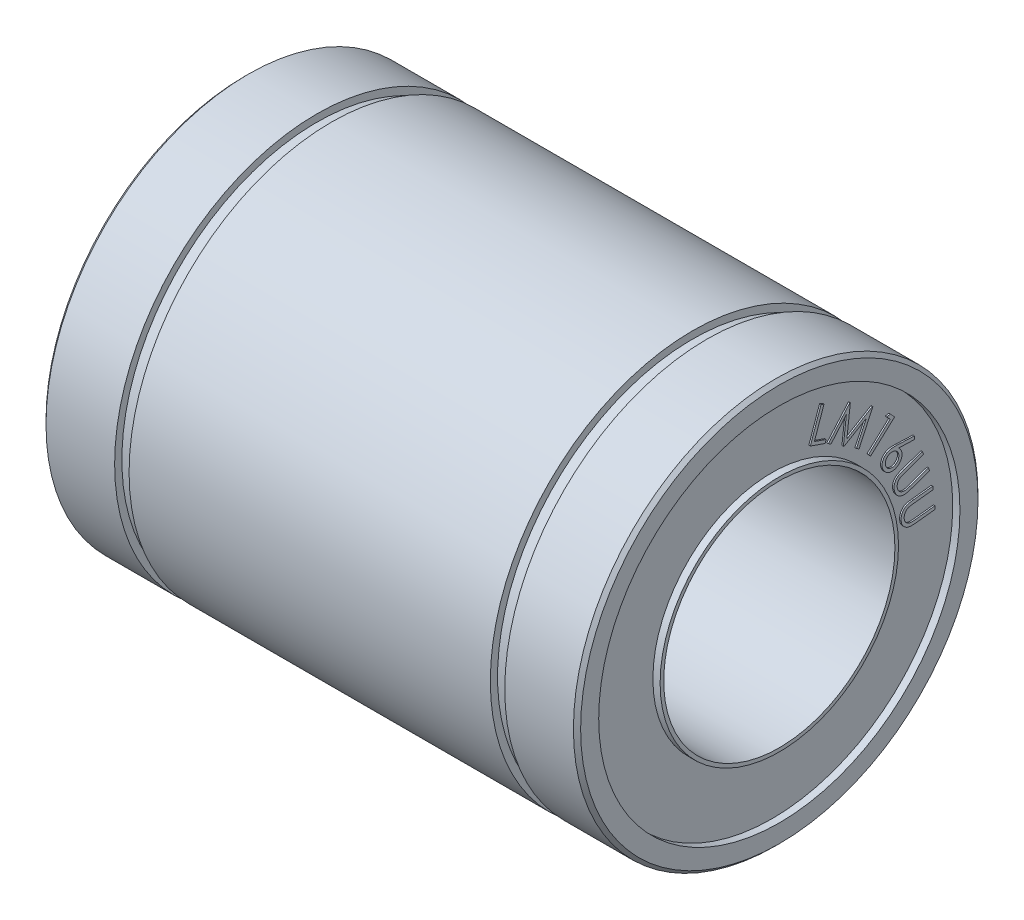
from build123d import *

# Parameters (mm, degrees)
SKETCH1_R           = 14
BOSS_EXTRUDE1_DEPTH = 37
SKETCH2_R           = 8
CUT_EXTRUDE1_DEPTH  = 37
SKETCH3_R           = 12.5
SKETCH3_R_2         = 8.25
CUT_EXTRUDE2_DEPTH  = 0.5
CUT_EXTRUDE3_START  = -36.5
SKETCH3_2_R         = 12.5
SKETCH3_2_R_2       = 8.25
CUT_EXTRUDE3_DEPTH  = 0.5
SKETCH4_W           = 1
SKETCH4_H           = 0.5
CHAMFER1_SIZE       = 0.25
BOSS_EXTRUDE2_DEPTH = 0.1
BOSS_EXTRUDE3_DEPTH = 0.1


with BuildPart() as part:
    # Sketch1 → Boss-Extrude1 (new body)
    with BuildSketch(Plane(origin=(0, 0, 0), x_dir=(0, 0, -1), z_dir=(1, 0, 0))):
        Circle(SKETCH1_R)
    extrude(amount=BOSS_EXTRUDE1_DEPTH)

    # Sketch2 → Cut-Extrude1 (cut)
    with BuildSketch(Plane(origin=(37, 0, 0), x_dir=(0, 0, -1), z_dir=(1, 0, 0))):
        Circle(SKETCH2_R)
    extrude(amount=-CUT_EXTRUDE1_DEPTH, mode=Mode.SUBTRACT)

    # Sketch3 → Cut-Extrude2 (cut)
    with BuildSketch(Plane(origin=(37, 0, 0), x_dir=(0, 0, -1), z_dir=(1, 0, 0))):
        Circle(SKETCH3_R)
        Circle(SKETCH3_R_2, mode=Mode.SUBTRACT)
    extrude(amount=-CUT_EXTRUDE2_DEPTH, mode=Mode.SUBTRACT)

    # Sketch3<2> → Cut-Extrude3 (cut)
    with BuildSketch(Plane(origin=(37, 0, 0), x_dir=(0, 0, -1), z_dir=(1, 0, 0)).offset(CUT_EXTRUDE3_START)):
        Circle(SKETCH3_2_R)
        Circle(SKETCH3_2_R_2, mode=Mode.SUBTRACT)
    extrude(amount=-CUT_EXTRUDE3_DEPTH, mode=Mode.SUBTRACT)

    # Sketch4 → Cut-Revolve1 (revolve, cut)
    with BuildSketch(Plane(origin=(0, 0, 0), x_dir=(1, 0, 0), z_dir=(0, 1, 0))):
        with Locations((31.5, 13.75)):
            Rectangle(SKETCH4_W, SKETCH4_H)
        with Locations((5.5, 13.75)):
            Rectangle(SKETCH4_W, SKETCH4_H)
    revolve(axis=Axis((37, 0, 0), (-1, 0, 0)), mode=Mode.SUBTRACT)

    # Chamfer1
    chamfer1_edges = [part.edges().sort_by_distance(p)[0] for p in [
        (0, 0, 14),
        (37, 0, 14),
    ]]
    chamfer(chamfer1_edges, length=CHAMFER1_SIZE)

    # Sketch5 → Boss-Extrude2 (add)
    # profile 1 of 6: a face of its own
    with BuildSketch(Plane(origin=(36.5, 0, 0), x_dir=(0, 0, -1), z_dir=(1, 0, 0))):
        with BuildLine():
            Line((11.023012647, 1.971806837), (11.04780231, 1.750052029))
            Line((11.04780231, 1.750052029), (9.709160483, 1.599961885))
            add(Edge.make_bspline(
                [(9.709160483, 1.599961885), (9.690222868, 1.597921149), (9.654276339, 1.594047516), (9.603230748, 1.587571213), (9.557846114, 1.581802568), (9.518033464, 1.576374225), (9.483923376, 1.571445809), (9.455324636, 1.567076165), (9.432472951, 1.562684486), (9.419187325, 1.559437758), (9.413487406, 1.558044818)],
                knots=[0, 0, 0, 0, 1.529972016, 2.904124054, 4.133084495, 5.204929471, 6.131682661, 6.901508298, 7.528715184, 8, 8, 8, 8], degree=3))
            add(Edge.make_bspline(
                [(9.413487406, 1.558044818), (9.392747753, 1.552515194), (9.352658543, 1.541826575), (9.296659801, 1.518351992), (9.24628813, 1.490669098), (9.201731633, 1.457237616), (9.162470696, 1.417629135), (9.128536627, 1.370323938), (9.098883075, 1.315668937), (9.074752567, 1.254567096), (9.056006582, 1.190299364), (9.044085043, 1.125076532), (9.039685932, 1.060285132), (9.042800864, 1.017620429), (9.044346781, 0.99644626)],
                knots=[0, 0, 0, 0, 1.044325408, 2.018653799, 2.948987695, 3.837309385, 4.722098006, 5.654415344, 6.662956212, 7.743194244, 8.84781608, 9.918545184, 10.96698973, 12, 12, 12, 12], degree=3))
            add(Edge.make_bspline(
                [(9.044346781, 0.99644626), (9.046911374, 0.978326506), (9.052018369, 0.942243775), (9.067555744, 0.889669421), (9.087526664, 0.838528544), (9.113904018, 0.790061827), (9.14451946, 0.744461067), (9.180730412, 0.704099901), (9.219389449, 0.666853239), (9.26304554, 0.635282177), (9.310699265, 0.60875784), (9.361743264, 0.586455923), (9.41682096, 0.56961161), (9.455165832, 0.56275501), (9.474785483, 0.559246741)],
                knots=[0, 0, 0, 0, 0.994312499, 1.980021912, 2.974132841, 3.976074961, 4.975814495, 5.954586996, 6.920166592, 7.891230619, 8.875617637, 9.882282318, 10.916442249, 12, 12, 12, 12], degree=3))
            add(Edge.make_bspline(
                [(9.474785483, 0.559246741), (9.483039375, 0.558236563), (9.501149688, 0.556020076), (9.531268097, 0.554953642), (9.566741781, 0.555013782), (9.607776907, 0.556419952), (9.654184382, 0.559353328), (9.706067448, 0.562690487), (9.763286423, 0.568342581), (9.803215688, 0.572728579), (9.824094378, 0.575021981)],
                knots=[0, 0, 0, 0, 0.569442986, 1.249445795, 2.062549003, 2.999670387, 4.061589447, 5.248081227, 6.561043948, 8, 8, 8, 8], degree=3))
            Line((9.824094378, 0.575021981), (11.162736205, 0.725112125))
            Line((11.162736205, 0.725112125), (11.187525868, 0.503808039))
            Line((11.187525868, 0.503808039), (9.848884041, 0.353717895))
            add(Edge.make_bspline(
                [(9.848884041, 0.353717895), (9.824708178, 0.351175948), (9.777611344, 0.346224), (9.708466167, 0.341277522), (9.642632883, 0.338522827), (9.580087268, 0.33794248), (9.520874068, 0.339938758), (9.465017207, 0.343056762), (9.412601375, 0.349752679), (9.362943131, 0.357445107), (9.315495715, 0.368959434), (9.269378949, 0.383635546), (9.224648268, 0.402929064), (9.180736778, 0.425288068), (9.138335211, 0.452220569), (9.09681021, 0.482505434), (9.056058017, 0.516274083), (9.017247532, 0.554109207), (8.980015649, 0.594497931), (8.947921856, 0.639132222), (8.91849703, 0.685635629), (8.894134776, 0.735425099), (8.872361759, 0.787418155), (8.856183884, 0.842711947), (8.84269483, 0.900446575), (8.837433785, 0.94019726), (8.834761445, 0.960388568)],
                knots=[0, 0, 0, 0, 1.301517019, 2.535476441, 3.710940068, 4.829130968, 5.88342943, 6.883000234, 7.822914096, 8.711621517, 9.572064124, 10.434459895, 11.299552767, 12.17741742, 13.07019317, 13.985728478, 14.928151944, 15.900983954, 16.886373419, 17.864611659, 18.840100778, 19.82942264, 20.828799209, 21.854348839, 22.910119357, 24, 24, 24, 24], degree=3))
            add(Edge.make_bspline(
                [(8.834761445, 0.960388568), (8.83263526, 0.982454024), (8.828461815, 1.025765851), (8.827816952, 1.090089518), (8.830883261, 1.152414682), (8.837921374, 1.212871914), (8.849684195, 1.271362941), (8.866042223, 1.327809844), (8.886275479, 1.382392741), (8.910537482, 1.434788627), (8.938958035, 1.483998328), (8.970014599, 1.530309711), (9.004412166, 1.572834402), (9.041787677, 1.61162383), (9.082219507, 1.646628244), (9.125700256, 1.677775803), (9.172224362, 1.705567523), (9.205253046, 1.720750668), (9.221930916, 1.728417414)],
                knots=[0, 0, 0, 0, 1.151477449, 2.260211214, 3.338991356, 4.392588726, 5.419971278, 6.435538955, 7.443425264, 8.442382105, 9.432051824, 10.393480485, 11.337216847, 12.270333585, 13.189133071, 14.112135491, 15.046720806, 16, 16, 16, 16], degree=3))
            add(Edge.make_bspline(
                [(9.221930916, 1.728417414), (9.233443958, 1.733076474), (9.258263278, 1.743120274), (9.299606219, 1.755925332), (9.347445003, 1.768446979), (9.401991117, 1.780635315), (9.46324972, 1.7916161), (9.53102022, 1.802429888), (9.605375019, 1.8129), (9.657310924, 1.818696548), (9.68437082, 1.821716693)],
                knots=[0, 0, 0, 0, 0.62976426, 1.35761862, 2.193128689, 3.137921082, 4.191712736, 5.349369248, 6.618955602, 8, 8, 8, 8], degree=3))
            Line((9.68437082, 1.821716693), (11.023012647, 1.971806837))
        make_face()
    # profile 2 of 6: a face of its own
    with BuildSketch(Plane(origin=(36.5, 0, 0), x_dir=(0, 0, -1), z_dir=(1, 0, 0))):
        with BuildLine():
            Line((10.304635883, 4.407349536), (10.379004873, 4.196412036))
            Line((10.379004873, 4.196412036), (9.103013287, 3.747043046))
            add(Edge.make_bspline(
                [(9.103013287, 3.747043046), (9.084973134, 3.740613984), (9.050815512, 3.728441055), (9.002369983, 3.71063583), (8.95912336, 3.695057391), (8.92122361, 3.68071611), (8.889068813, 3.667567531), (8.862064476, 3.656729168), (8.840432802, 3.64753701), (8.828046208, 3.641180776), (8.822664729, 3.638419248)],
                knots=[0, 0, 0, 0, 1.528012504, 2.893172574, 4.118027454, 5.195532393, 6.12598041, 6.889492807, 7.517529131, 8, 8, 8, 8], degree=3))
            add(Edge.make_bspline(
                [(8.822664729, 3.638419248), (8.803814642, 3.628278169), (8.767297907, 3.608632685), (8.717540751, 3.573729419), (8.675077, 3.534742331), (8.638430401, 3.492380851), (8.609203232, 3.44434663), (8.586023855, 3.390543036), (8.569621391, 3.330138506), (8.559688051, 3.264976108), (8.555926855, 3.197756427), (8.559684086, 3.131468599), (8.569587521, 3.067034312), (8.582362418, 3.026062469), (8.58874045, 3.005606748)],
                knots=[0, 0, 0, 0, 1.037782282, 2.010410958, 2.938952049, 3.828281059, 4.718266819, 5.655150867, 6.661280109, 7.745667108, 8.847715622, 9.920653619, 10.961859501, 12, 12, 12, 12], degree=3))
            add(Edge.make_bspline(
                [(8.58874045, 3.005606748), (8.595426822, 2.988461231), (8.608714654, 2.954387931), (8.635343037, 2.906209569), (8.666994722, 2.86111357), (8.703286141, 2.819114373), (8.744351645, 2.782103047), (8.787959644, 2.749261978), (8.834963294, 2.722494899), (8.884662055, 2.701140895), (8.937253531, 2.685981404), (8.992189993, 2.675938332), (9.049796596, 2.671753926), (9.088893265, 2.673754882), (9.108872662, 2.674777421)],
                knots=[0, 0, 0, 0, 0.995576105, 1.978509248, 2.97148967, 3.974746577, 4.976683408, 5.959380889, 6.924993764, 7.898081935, 8.88141894, 9.881868605, 10.917580726, 12, 12, 12, 12], degree=3))
            add(Edge.make_bspline(
                [(9.108872662, 2.674777421), (9.117149093, 2.675737509), (9.135292459, 2.677842186), (9.16492563, 2.683495823), (9.199557055, 2.691840005), (9.239484092, 2.701985245), (9.284212829, 2.715277005), (9.333922122, 2.731141801), (9.388705807, 2.749648506), (9.426942113, 2.762938181), (9.446913527, 2.769879584)],
                knots=[0, 0, 0, 0, 0.568236828, 1.245673133, 2.056114611, 2.998233693, 4.055511394, 5.238583063, 6.557669229, 8, 8, 8, 8], degree=3))
            Line((9.446913527, 2.769879584), (10.722905114, 3.219248575))
            Line((10.722905114, 3.219248575), (10.797274104, 3.008311075))
            Line((10.797274104, 3.008311075), (9.521282518, 2.558942084))
            add(Edge.make_bspline(
                [(9.521282518, 2.558942084), (9.498182078, 2.551020545), (9.453055401, 2.535545829), (9.386525721, 2.514764904), (9.322743909, 2.497225705), (9.261816231, 2.482022759), (9.203396384, 2.470558433), (9.14797963, 2.461229634), (9.095304912, 2.455466429), (9.045077818, 2.451955273), (8.996089296, 2.452338), (8.947687483, 2.45686488), (8.899519254, 2.465579142), (8.851518408, 2.477628858), (8.803854715, 2.494200757), (8.756162208, 2.514319746), (8.708900876, 2.538904162), (8.661974048, 2.566644862), (8.616918217, 2.5982537), (8.574501661, 2.633645126), (8.535762681, 2.673050425), (8.500154347, 2.715845307), (8.467809129, 2.762252066), (8.43925736, 2.812344359), (8.41309394, 2.865806116), (8.39897724, 2.903462733), (8.391775306, 2.922674055)],
                knots=[0, 0, 0, 0, 1.301885919, 2.543232421, 3.714979024, 4.828100692, 5.889958941, 6.888068622, 7.822989329, 8.713812229, 9.570868361, 10.431621696, 11.302046928, 12.178165476, 13.067222264, 13.989569946, 14.935270159, 15.905050795, 16.893894155, 17.866086322, 18.845903127, 19.835524696, 20.830931213, 21.857181809, 22.906795792, 24, 24, 24, 24], degree=3))
            add(Edge.make_bspline(
                [(8.391775306, 2.922674055), (8.384677599, 2.943760312), (8.370717593, 2.985233466), (8.355893259, 3.04807829), (8.344023156, 3.109654709), (8.337994225, 3.170429104), (8.33584265, 3.230397377), (8.339348401, 3.289282778), (8.3462039, 3.347390192), (8.358643525, 3.40396492), (8.374570644, 3.45876778), (8.394942882, 3.510964023), (8.419525303, 3.56001083), (8.446818132, 3.606800153), (8.478544391, 3.650279186), (8.514468074, 3.690394446), (8.553661334, 3.728124016), (8.582375355, 3.750589421), (8.596853431, 3.761916844)],
                knots=[0, 0, 0, 0, 1.15035069, 2.262548104, 3.337289598, 4.392175084, 5.41858764, 6.438209531, 7.440804167, 8.442343836, 9.430983373, 10.390789764, 11.336233204, 12.266637723, 13.190068916, 14.115003483, 15.049554095, 16, 16, 16, 16], degree=3))
            add(Edge.make_bspline(
                [(8.596853431, 3.761916844), (8.606968145, 3.769133712), (8.628876712, 3.784765517), (8.666616499, 3.806501879), (8.710830555, 3.829498342), (8.761877527, 3.853044672), (8.81892271, 3.87848385), (8.882990835, 3.904011593), (8.953414431, 3.931034903), (9.00291615, 3.948765304), (9.028644296, 3.957980546)],
                knots=[0, 0, 0, 0, 0.626710171, 1.357460281, 2.195047274, 3.141321219, 4.193635682, 5.346687564, 6.62096083, 8, 8, 8, 8], degree=3))
            Line((9.028644296, 3.957980546), (10.304635883, 4.407349536))
        make_face()
    # profile 3 of 6: a face of its own
    with BuildSketch(Plane(origin=(36.5, 0, 0), x_dir=(0, 0, -1), z_dir=(1, 0, 0))):
        with BuildLine():
            Line((9.746772234, 5.622091487), (9.739560696, 5.402139564))
            Line((9.739560696, 5.402139564), (8.646111177, 5.440450862))
            add(Edge.make_bspline(
                [(8.646111177, 5.440450862), (8.661774786, 5.426682164), (8.69220566, 5.399932677), (8.733707758, 5.3573113), (8.769373381, 5.313313285), (8.789535554, 5.282421199), (8.799356369, 5.267373939)],
                knots=[0, 0, 0, 0, 1.077802223, 2.093927627, 3.071569074, 4, 4, 4, 4], degree=3))
            add(Edge.make_bspline(
                [(8.799356369, 5.267373939), (8.810292837, 5.24850908), (8.831805412, 5.21140097), (8.856454958, 5.152727712), (8.875129508, 5.093444939), (8.887563505, 5.033049139), (8.892784579, 4.971509245), (8.891882583, 4.908998016), (8.884528031, 4.845610759), (8.871075206, 4.782089251), (8.851771677, 4.719786239), (8.82728249, 4.660016884), (8.796072637, 4.604360405), (8.760378221, 4.551720306), (8.71939708, 4.50239781), (8.672345767, 4.457249809), (8.620576118, 4.41491716), (8.582518644, 4.39050629), (8.563178484, 4.378101102)],
                knots=[0, 0, 0, 0, 1.020111462, 2.006609746, 2.972219884, 3.926903679, 4.887323846, 5.858198153, 6.849450432, 7.870410462, 8.893936148, 9.899881421, 10.888559372, 11.87583487, 12.874696021, 13.884569057, 14.924974033, 16, 16, 16, 16], degree=3))
            add(Edge.make_bspline(
                [(8.563178484, 4.378101102), (8.535734834, 4.362665106), (8.481901226, 4.332385777), (8.396085086, 4.299687447), (8.308461006, 4.279146532), (8.219415464, 4.271078856), (8.130379398, 4.275050231), (8.042751565, 4.291492839), (7.957015482, 4.319924142), (7.874180245, 4.359726111), (7.796772491, 4.4105852), (7.726065928, 4.469886065), (7.66399703, 4.538596111), (7.629856389, 4.590073858), (7.612607571, 4.616081871)],
                knots=[0, 0, 0, 0, 1.036506601, 2.033216742, 3.014385835, 3.993792065, 4.970152704, 5.942172962, 6.922267211, 7.938678482, 8.961724237, 9.966492939, 10.972614702, 12, 12, 12, 12], degree=3))
            add(Edge.make_bspline(
                [(7.612607571, 4.616081871), (7.597726351, 4.642310014), (7.568253498, 4.694255904), (7.537600949, 4.778152827), (7.516673798, 4.86445645), (7.508444456, 4.953051981), (7.511289398, 5.041909268), (7.526864862, 5.129102581), (7.554198838, 5.213907078), (7.593420516, 5.295022581), (7.642770817, 5.370819745), (7.700923303, 5.439547548), (7.767421765, 5.500175084), (7.817371223, 5.533318518), (7.842475359, 5.549976102)],
                knots=[0, 0, 0, 0, 1.011924724, 2.004157542, 2.990049326, 3.989361336, 4.984685489, 5.969218716, 6.956028083, 7.970029198, 8.988182909, 9.987686243, 10.9886297, 12, 12, 12, 12], degree=3))
            add(Edge.make_bspline(
                [(7.842475359, 5.549976102), (7.862562825, 5.561325831), (7.903583031, 5.584502883), (7.970065423, 5.612644026), (8.04163171, 5.635526866), (8.104885366, 5.650439544), (8.158890965, 5.659960693), (8.202959289, 5.665750406), (8.250183045, 5.670093131), (8.300351958, 5.673916896), (8.353732745, 5.675526309), (8.409931246, 5.675796502), (8.469300743, 5.675662008), (8.509846666, 5.673920038), (8.530726561, 5.673022977)],
                knots=[0, 0, 0, 0, 1.169849696, 2.388926373, 3.654468859, 4.978263442, 5.682551577, 6.436100894, 7.232497672, 8.088393346, 8.988365595, 9.941209239, 10.939786517, 12, 12, 12, 12], degree=3))
            Line((8.530726561, 5.673022977), (9.746772234, 5.622091487))
        make_face()
        with BuildLine():
            add(Edge.make_bspline(
                [(8.604194109, 5.211033794), (8.595604893, 5.224451994), (8.578721931, 5.250826806), (8.548975073, 5.28653321), (8.516913265, 5.318952455), (8.481588109, 5.347120021), (8.444037145, 5.372452472), (8.403240238, 5.392836612), (8.360122238, 5.410395984), (8.314534439, 5.423015962), (8.268126604, 5.432090173), (8.22179074, 5.436694017), (8.176053268, 5.436668005), (8.130842195, 5.43232536), (8.086462685, 5.422679892), (8.042907984, 5.408490555), (7.999693645, 5.390133119), (7.972276384, 5.374198553), (7.958310696, 5.366081871)],
                knots=[0, 0, 0, 0, 1.033751752, 2.031942289, 3.011649784, 3.989947241, 4.961457835, 5.947654492, 6.945988081, 7.98066036, 9.013997607, 10.01399862, 10.999471001, 11.980052671, 12.957960795, 13.942273228, 14.951843847, 16, 16, 16, 16], degree=3))
            add(Edge.make_bspline(
                [(7.958310696, 5.366081871), (7.944892496, 5.357492655), (7.918517684, 5.340609693), (7.88281128, 5.310862835), (7.850392035, 5.278801027), (7.822224471, 5.243475871), (7.796892014, 5.205924908), (7.776507891, 5.165127997), (7.758948456, 5.12201001), (7.746328725, 5.076422159), (7.737253598, 5.030014516), (7.732653047, 4.983677965), (7.732666999, 4.938092697), (7.737018109, 4.893020606), (7.746817548, 4.84890052), (7.760155986, 4.805255753), (7.778877457, 4.762606524), (7.794445868, 4.735388725), (7.802361177, 4.721550621)],
                knots=[0, 0, 0, 0, 1.036009441, 2.036380003, 3.018227155, 3.998661191, 4.972293542, 5.960644028, 6.961157955, 7.998089933, 9.033683964, 10.035868956, 11.023493586, 11.996487376, 12.976531228, 13.960032551, 14.962837515, 16, 16, 16, 16], degree=3))
            add(Edge.make_bspline(
                [(7.802361177, 4.721550621), (7.810910015, 4.708096812), (7.82776511, 4.681570957), (7.858237091, 4.646231154), (7.889755932, 4.61311262), (7.925601107, 4.585533068), (7.962942934, 4.56010826), (8.003762515, 4.539718584), (8.046963051, 4.522317819), (8.0923873, 4.508974955), (8.138890428, 4.500081766), (8.185212898, 4.495432118), (8.230801833, 4.495458857), (8.275872959, 4.499806601), (8.319993304, 4.509606944), (8.363638001, 4.522945138), (8.406287249, 4.541666675), (8.433505046, 4.557235077), (8.447343148, 4.565150381)],
                knots=[0, 0, 0, 0, 1.035376435, 2.041373163, 3.029554756, 4.003279005, 4.976316461, 5.964063061, 6.96396567, 8.002979135, 9.037940413, 10.039513066, 11.026534253, 11.998933539, 12.97837858, 13.96127898, 14.963471226, 16, 16, 16, 16], degree=3))
            add(Edge.make_bspline(
                [(8.447343148, 4.565150381), (8.460908306, 4.573893185), (8.48758052, 4.591083544), (8.523625986, 4.621101592), (8.556071842, 4.653517097), (8.585078333, 4.688392186), (8.609330169, 4.726893962), (8.630662363, 4.76728476), (8.648004366, 4.810604552), (8.660691538, 4.856153994), (8.66974948, 4.902572273), (8.674351033, 4.948904979), (8.674349345, 4.99449523), (8.669948948, 5.039551367), (8.66032584, 5.083775211), (8.646264209, 5.12723811), (8.627717994, 5.169990663), (8.612122956, 5.197199996), (8.604194109, 5.211033794)],
                knots=[0, 0, 0, 0, 1.046714666, 2.05808129, 3.037247837, 4.021161769, 4.994972051, 5.98510039, 6.982882747, 8.01698373, 9.049750418, 10.049199279, 11.03412753, 12.004464886, 12.981833057, 13.965602, 14.965669141, 16, 16, 16, 16], degree=3))
        make_face(mode=Mode.SUBTRACT)
    # profile 4 of 6: a face of its own
    with BuildSketch(Plane(origin=(36.5, 0, 0), x_dir=(0, 0, -1), z_dir=(1, 0, 0))):
        Polygon((8.080595073, 7.765214307), (8.377620314, 7.439793634), (6.71986791, 5.926271999), (6.569327044, 6.090785221), (8.064819833, 7.456019596), (7.827740506, 7.716085701), align=None)
    # profile 5 of 6: a face of its own
    with BuildSketch(Plane(origin=(36.5, 0, 0), x_dir=(0, 0, -1), z_dir=(1, 0, 0))):
        Polygon((3.792611229, 8.133852781), (5.284498248, 9.845241002), (5.315147286, 9.825409271), (5.077617238, 7.780487396), (6.840387671, 8.834724175), (6.871036709, 8.814892444), (5.917310748, 6.754195329), (5.731613633, 6.874537877), (6.423019883, 8.342987396), (4.880652094, 7.427122012), (4.833326373, 7.45777105), (5.039756661, 9.255247012), (3.974251854, 8.015763839), align=None)
    # profile 6 of 6: a face of its own
    with BuildSketch(Plane(origin=(36.5, 0, 0), x_dir=(0, 0, -1), z_dir=(1, 0, 0))):
        Polygon((3.283503495, 10.728110103), (3.495793159, 10.653741113), (2.827373687, 8.744486305), (3.639122485, 8.460081257), (3.567457822, 8.255904574), (2.54341936, 8.614678613), align=None)
    extrude(amount=BOSS_EXTRUDE2_DEPTH)

    # Sketch6 → Boss-Extrude3 (add)
    # profile 1 of 6: a face of its own
    with BuildSketch(Plane.ZY.offset(-0.5)):
        with BuildLine():
            Line((11.023012647, 1.971806837), (11.04780231, 1.750052029))
            Line((11.04780231, 1.750052029), (9.709160483, 1.599961885))
            add(Edge.make_bspline(
                [(9.709160483, 1.599961885), (9.690222868, 1.597921149), (9.654276339, 1.594047516), (9.603230748, 1.587571213), (9.557846114, 1.581802568), (9.518033464, 1.576374225), (9.483923376, 1.571445809), (9.455324636, 1.567076165), (9.432472951, 1.562684486), (9.419187325, 1.559437758), (9.413487406, 1.558044818)],
                knots=[0, 0, 0, 0, 1.529972016, 2.904124054, 4.133084495, 5.204929471, 6.131682661, 6.901508298, 7.528715184, 8, 8, 8, 8], degree=3))
            add(Edge.make_bspline(
                [(9.413487406, 1.558044818), (9.392747753, 1.552515194), (9.352658543, 1.541826575), (9.296659801, 1.518351992), (9.24628813, 1.490669098), (9.201731633, 1.457237616), (9.162470696, 1.417629135), (9.128536627, 1.370323938), (9.098883075, 1.315668937), (9.074752567, 1.254567096), (9.056006582, 1.190299364), (9.044085043, 1.125076532), (9.039685932, 1.060285132), (9.042800864, 1.017620429), (9.044346781, 0.99644626)],
                knots=[0, 0, 0, 0, 1.044325408, 2.018653799, 2.948987695, 3.837309385, 4.722098006, 5.654415344, 6.662956212, 7.743194244, 8.84781608, 9.918545184, 10.96698973, 12, 12, 12, 12], degree=3))
            add(Edge.make_bspline(
                [(9.044346781, 0.99644626), (9.046911374, 0.978326506), (9.052018369, 0.942243775), (9.067555744, 0.889669421), (9.087526664, 0.838528544), (9.113904018, 0.790061827), (9.14451946, 0.744461067), (9.180730412, 0.704099901), (9.219389449, 0.666853239), (9.26304554, 0.635282177), (9.310699265, 0.60875784), (9.361743264, 0.586455923), (9.41682096, 0.56961161), (9.455165832, 0.56275501), (9.474785483, 0.559246741)],
                knots=[0, 0, 0, 0, 0.994312499, 1.980021912, 2.974132841, 3.976074961, 4.975814495, 5.954586996, 6.920166592, 7.891230619, 8.875617637, 9.882282318, 10.916442249, 12, 12, 12, 12], degree=3))
            add(Edge.make_bspline(
                [(9.474785483, 0.559246741), (9.483039375, 0.558236563), (9.501149688, 0.556020076), (9.531268097, 0.554953642), (9.566741781, 0.555013782), (9.607776907, 0.556419952), (9.654184382, 0.559353328), (9.706067448, 0.562690487), (9.763286423, 0.568342581), (9.803215688, 0.572728579), (9.824094378, 0.575021981)],
                knots=[0, 0, 0, 0, 0.569442986, 1.249445795, 2.062549003, 2.999670387, 4.061589447, 5.248081227, 6.561043948, 8, 8, 8, 8], degree=3))
            Line((9.824094378, 0.575021981), (11.162736205, 0.725112125))
            Line((11.162736205, 0.725112125), (11.187525868, 0.503808039))
            Line((11.187525868, 0.503808039), (9.848884041, 0.353717895))
            add(Edge.make_bspline(
                [(9.848884041, 0.353717895), (9.824708178, 0.351175948), (9.777611344, 0.346224), (9.708466167, 0.341277522), (9.642632883, 0.338522827), (9.580087268, 0.33794248), (9.520874068, 0.339938758), (9.465017207, 0.343056762), (9.412601375, 0.349752679), (9.362943131, 0.357445107), (9.315495715, 0.368959434), (9.269378949, 0.383635546), (9.224648268, 0.402929064), (9.180736778, 0.425288068), (9.138335211, 0.452220569), (9.09681021, 0.482505434), (9.056058017, 0.516274083), (9.017247532, 0.554109207), (8.980015649, 0.594497931), (8.947921856, 0.639132222), (8.91849703, 0.685635629), (8.894134776, 0.735425099), (8.872361759, 0.787418155), (8.856183884, 0.842711947), (8.84269483, 0.900446575), (8.837433785, 0.94019726), (8.834761445, 0.960388568)],
                knots=[0, 0, 0, 0, 1.301517019, 2.535476441, 3.710940068, 4.829130968, 5.88342943, 6.883000234, 7.822914096, 8.711621517, 9.572064124, 10.434459895, 11.299552767, 12.17741742, 13.07019317, 13.985728478, 14.928151944, 15.900983954, 16.886373419, 17.864611659, 18.840100778, 19.82942264, 20.828799209, 21.854348839, 22.910119357, 24, 24, 24, 24], degree=3))
            add(Edge.make_bspline(
                [(8.834761445, 0.960388568), (8.83263526, 0.982454024), (8.828461815, 1.025765851), (8.827816952, 1.090089518), (8.830883261, 1.152414682), (8.837921374, 1.212871914), (8.849684195, 1.271362941), (8.866042223, 1.327809844), (8.886275479, 1.382392741), (8.910537482, 1.434788627), (8.938958035, 1.483998328), (8.970014599, 1.530309711), (9.004412166, 1.572834402), (9.041787677, 1.61162383), (9.082219507, 1.646628244), (9.125700256, 1.677775803), (9.172224362, 1.705567523), (9.205253046, 1.720750668), (9.221930916, 1.728417414)],
                knots=[0, 0, 0, 0, 1.151477449, 2.260211214, 3.338991356, 4.392588726, 5.419971278, 6.435538955, 7.443425264, 8.442382105, 9.432051824, 10.393480485, 11.337216847, 12.270333585, 13.189133071, 14.112135491, 15.046720806, 16, 16, 16, 16], degree=3))
            add(Edge.make_bspline(
                [(9.221930916, 1.728417414), (9.233443958, 1.733076474), (9.258263278, 1.743120274), (9.299606219, 1.755925332), (9.347445003, 1.768446979), (9.401991117, 1.780635315), (9.46324972, 1.7916161), (9.53102022, 1.802429888), (9.605375019, 1.8129), (9.657310924, 1.818696548), (9.68437082, 1.821716693)],
                knots=[0, 0, 0, 0, 0.62976426, 1.35761862, 2.193128689, 3.137921082, 4.191712736, 5.349369248, 6.618955602, 8, 8, 8, 8], degree=3))
            Line((9.68437082, 1.821716693), (11.023012647, 1.971806837))
        make_face()
    # profile 2 of 6: a face of its own
    with BuildSketch(Plane.ZY.offset(-0.5)):
        with BuildLine():
            Line((10.304635883, 4.407349536), (10.379004873, 4.196412036))
            Line((10.379004873, 4.196412036), (9.103013287, 3.747043046))
            add(Edge.make_bspline(
                [(9.103013287, 3.747043046), (9.084973134, 3.740613984), (9.050815512, 3.728441055), (9.002369983, 3.71063583), (8.95912336, 3.695057391), (8.92122361, 3.68071611), (8.889068813, 3.667567531), (8.862064476, 3.656729168), (8.840432802, 3.64753701), (8.828046208, 3.641180776), (8.822664729, 3.638419248)],
                knots=[0, 0, 0, 0, 1.528012504, 2.893172574, 4.118027454, 5.195532393, 6.12598041, 6.889492807, 7.517529131, 8, 8, 8, 8], degree=3))
            add(Edge.make_bspline(
                [(8.822664729, 3.638419248), (8.803814642, 3.628278169), (8.767297907, 3.608632685), (8.717540751, 3.573729419), (8.675077, 3.534742331), (8.638430401, 3.492380851), (8.609203232, 3.44434663), (8.586023855, 3.390543036), (8.569621391, 3.330138506), (8.559688051, 3.264976108), (8.555926855, 3.197756427), (8.559684086, 3.131468599), (8.569587521, 3.067034312), (8.582362418, 3.026062469), (8.58874045, 3.005606748)],
                knots=[0, 0, 0, 0, 1.037782282, 2.010410958, 2.938952049, 3.828281059, 4.718266819, 5.655150867, 6.661280109, 7.745667108, 8.847715622, 9.920653619, 10.961859501, 12, 12, 12, 12], degree=3))
            add(Edge.make_bspline(
                [(8.58874045, 3.005606748), (8.595426822, 2.988461231), (8.608714654, 2.954387931), (8.635343037, 2.906209569), (8.666994722, 2.86111357), (8.703286141, 2.819114373), (8.744351645, 2.782103047), (8.787959644, 2.749261978), (8.834963294, 2.722494899), (8.884662055, 2.701140895), (8.937253531, 2.685981404), (8.992189993, 2.675938332), (9.049796596, 2.671753926), (9.088893265, 2.673754882), (9.108872662, 2.674777421)],
                knots=[0, 0, 0, 0, 0.995576105, 1.978509248, 2.97148967, 3.974746577, 4.976683408, 5.959380889, 6.924993764, 7.898081935, 8.88141894, 9.881868605, 10.917580726, 12, 12, 12, 12], degree=3))
            add(Edge.make_bspline(
                [(9.108872662, 2.674777421), (9.117149093, 2.675737509), (9.135292459, 2.677842186), (9.16492563, 2.683495823), (9.199557055, 2.691840005), (9.239484092, 2.701985245), (9.284212829, 2.715277005), (9.333922122, 2.731141801), (9.388705807, 2.749648506), (9.426942113, 2.762938181), (9.446913527, 2.769879584)],
                knots=[0, 0, 0, 0, 0.568236828, 1.245673133, 2.056114611, 2.998233693, 4.055511394, 5.238583063, 6.557669229, 8, 8, 8, 8], degree=3))
            Line((9.446913527, 2.769879584), (10.722905114, 3.219248575))
            Line((10.722905114, 3.219248575), (10.797274104, 3.008311075))
            Line((10.797274104, 3.008311075), (9.521282518, 2.558942084))
            add(Edge.make_bspline(
                [(9.521282518, 2.558942084), (9.498182078, 2.551020545), (9.453055401, 2.535545829), (9.386525721, 2.514764904), (9.322743909, 2.497225705), (9.261816231, 2.482022759), (9.203396384, 2.470558433), (9.14797963, 2.461229634), (9.095304912, 2.455466429), (9.045077818, 2.451955273), (8.996089296, 2.452338), (8.947687483, 2.45686488), (8.899519254, 2.465579142), (8.851518408, 2.477628858), (8.803854715, 2.494200757), (8.756162208, 2.514319746), (8.708900876, 2.538904162), (8.661974048, 2.566644862), (8.616918217, 2.5982537), (8.574501661, 2.633645126), (8.535762681, 2.673050425), (8.500154347, 2.715845307), (8.467809129, 2.762252066), (8.43925736, 2.812344359), (8.41309394, 2.865806116), (8.39897724, 2.903462733), (8.391775306, 2.922674055)],
                knots=[0, 0, 0, 0, 1.301885919, 2.543232421, 3.714979024, 4.828100692, 5.889958941, 6.888068622, 7.822989329, 8.713812229, 9.570868361, 10.431621696, 11.302046928, 12.178165476, 13.067222264, 13.989569946, 14.935270159, 15.905050795, 16.893894155, 17.866086322, 18.845903127, 19.835524696, 20.830931213, 21.857181809, 22.906795792, 24, 24, 24, 24], degree=3))
            add(Edge.make_bspline(
                [(8.391775306, 2.922674055), (8.384677599, 2.943760312), (8.370717593, 2.985233466), (8.355893259, 3.04807829), (8.344023156, 3.109654709), (8.337994225, 3.170429104), (8.33584265, 3.230397377), (8.339348401, 3.289282778), (8.3462039, 3.347390192), (8.358643525, 3.40396492), (8.374570644, 3.45876778), (8.394942882, 3.510964023), (8.419525303, 3.56001083), (8.446818132, 3.606800153), (8.478544391, 3.650279186), (8.514468074, 3.690394446), (8.553661334, 3.728124016), (8.582375355, 3.750589421), (8.596853431, 3.761916844)],
                knots=[0, 0, 0, 0, 1.15035069, 2.262548104, 3.337289598, 4.392175084, 5.41858764, 6.438209531, 7.440804167, 8.442343836, 9.430983373, 10.390789764, 11.336233204, 12.266637723, 13.190068916, 14.115003483, 15.049554095, 16, 16, 16, 16], degree=3))
            add(Edge.make_bspline(
                [(8.596853431, 3.761916844), (8.606968145, 3.769133712), (8.628876712, 3.784765517), (8.666616499, 3.806501879), (8.710830555, 3.829498342), (8.761877527, 3.853044672), (8.81892271, 3.87848385), (8.882990835, 3.904011593), (8.953414431, 3.931034903), (9.00291615, 3.948765304), (9.028644296, 3.957980546)],
                knots=[0, 0, 0, 0, 0.626710171, 1.357460281, 2.195047274, 3.141321219, 4.193635682, 5.346687564, 6.62096083, 8, 8, 8, 8], degree=3))
            Line((9.028644296, 3.957980546), (10.304635883, 4.407349536))
        make_face()
    # profile 3 of 6: a face of its own
    with BuildSketch(Plane.ZY.offset(-0.5)):
        with BuildLine():
            Line((9.746772234, 5.622091487), (9.739560696, 5.402139564))
            Line((9.739560696, 5.402139564), (8.646111177, 5.440450862))
            add(Edge.make_bspline(
                [(8.646111177, 5.440450862), (8.661774786, 5.426682164), (8.69220566, 5.399932677), (8.733707758, 5.3573113), (8.769373381, 5.313313285), (8.789535554, 5.282421199), (8.799356369, 5.267373939)],
                knots=[0, 0, 0, 0, 1.077802223, 2.093927627, 3.071569074, 4, 4, 4, 4], degree=3))
            add(Edge.make_bspline(
                [(8.799356369, 5.267373939), (8.810292837, 5.24850908), (8.831805412, 5.21140097), (8.856454958, 5.152727712), (8.875129508, 5.093444939), (8.887563505, 5.033049139), (8.892784579, 4.971509245), (8.891882583, 4.908998016), (8.884528031, 4.845610759), (8.871075206, 4.782089251), (8.851771677, 4.719786239), (8.82728249, 4.660016884), (8.796072637, 4.604360405), (8.760378221, 4.551720306), (8.71939708, 4.50239781), (8.672345767, 4.457249809), (8.620576118, 4.41491716), (8.582518644, 4.39050629), (8.563178484, 4.378101102)],
                knots=[0, 0, 0, 0, 1.020111462, 2.006609746, 2.972219884, 3.926903679, 4.887323846, 5.858198153, 6.849450432, 7.870410462, 8.893936148, 9.899881421, 10.888559372, 11.87583487, 12.874696021, 13.884569057, 14.924974033, 16, 16, 16, 16], degree=3))
            add(Edge.make_bspline(
                [(8.563178484, 4.378101102), (8.535734834, 4.362665106), (8.481901226, 4.332385777), (8.396085086, 4.299687447), (8.308461006, 4.279146532), (8.219415464, 4.271078856), (8.130379398, 4.275050231), (8.042751565, 4.291492839), (7.957015482, 4.319924142), (7.874180245, 4.359726111), (7.796772491, 4.4105852), (7.726065928, 4.469886065), (7.66399703, 4.538596111), (7.629856389, 4.590073858), (7.612607571, 4.616081871)],
                knots=[0, 0, 0, 0, 1.036506601, 2.033216742, 3.014385835, 3.993792065, 4.970152704, 5.942172962, 6.922267211, 7.938678482, 8.961724237, 9.966492939, 10.972614702, 12, 12, 12, 12], degree=3))
            add(Edge.make_bspline(
                [(7.612607571, 4.616081871), (7.597726351, 4.642310014), (7.568253498, 4.694255904), (7.537600949, 4.778152827), (7.516673798, 4.86445645), (7.508444456, 4.953051981), (7.511289398, 5.041909268), (7.526864862, 5.129102581), (7.554198838, 5.213907078), (7.593420516, 5.295022581), (7.642770817, 5.370819745), (7.700923303, 5.439547548), (7.767421765, 5.500175084), (7.817371223, 5.533318518), (7.842475359, 5.549976102)],
                knots=[0, 0, 0, 0, 1.011924724, 2.004157542, 2.990049326, 3.989361336, 4.984685489, 5.969218716, 6.956028083, 7.970029198, 8.988182909, 9.987686243, 10.9886297, 12, 12, 12, 12], degree=3))
            add(Edge.make_bspline(
                [(7.842475359, 5.549976102), (7.862562825, 5.561325831), (7.903583031, 5.584502883), (7.970065423, 5.612644026), (8.04163171, 5.635526866), (8.104885366, 5.650439544), (8.158890965, 5.659960693), (8.202959289, 5.665750406), (8.250183045, 5.670093131), (8.300351958, 5.673916896), (8.353732745, 5.675526309), (8.409931246, 5.675796502), (8.469300743, 5.675662008), (8.509846666, 5.673920038), (8.530726561, 5.673022977)],
                knots=[0, 0, 0, 0, 1.169849696, 2.388926373, 3.654468859, 4.978263442, 5.682551577, 6.436100894, 7.232497672, 8.088393346, 8.988365595, 9.941209239, 10.939786517, 12, 12, 12, 12], degree=3))
            Line((8.530726561, 5.673022977), (9.746772234, 5.622091487))
        make_face()
        with BuildLine():
            add(Edge.make_bspline(
                [(8.604194109, 5.211033794), (8.595604893, 5.224451994), (8.578721931, 5.250826806), (8.548975073, 5.28653321), (8.516913265, 5.318952455), (8.481588109, 5.347120021), (8.444037145, 5.372452472), (8.403240238, 5.392836612), (8.360122238, 5.410395984), (8.314534439, 5.423015962), (8.268126604, 5.432090173), (8.22179074, 5.436694017), (8.176053268, 5.436668005), (8.130842195, 5.43232536), (8.086462685, 5.422679892), (8.042907984, 5.408490555), (7.999693645, 5.390133119), (7.972276384, 5.374198553), (7.958310696, 5.366081871)],
                knots=[0, 0, 0, 0, 1.033751752, 2.031942289, 3.011649784, 3.989947241, 4.961457835, 5.947654492, 6.945988081, 7.98066036, 9.013997607, 10.01399862, 10.999471001, 11.980052671, 12.957960795, 13.942273228, 14.951843847, 16, 16, 16, 16], degree=3))
            add(Edge.make_bspline(
                [(7.958310696, 5.366081871), (7.944892496, 5.357492655), (7.918517684, 5.340609693), (7.88281128, 5.310862835), (7.850392035, 5.278801027), (7.822224471, 5.243475871), (7.796892014, 5.205924908), (7.776507891, 5.165127997), (7.758948456, 5.12201001), (7.746328725, 5.076422159), (7.737253598, 5.030014516), (7.732653047, 4.983677965), (7.732666999, 4.938092697), (7.737018109, 4.893020606), (7.746817548, 4.84890052), (7.760155986, 4.805255753), (7.778877457, 4.762606524), (7.794445868, 4.735388725), (7.802361177, 4.721550621)],
                knots=[0, 0, 0, 0, 1.036009441, 2.036380003, 3.018227155, 3.998661191, 4.972293542, 5.960644028, 6.961157955, 7.998089933, 9.033683964, 10.035868956, 11.023493586, 11.996487376, 12.976531228, 13.960032551, 14.962837515, 16, 16, 16, 16], degree=3))
            add(Edge.make_bspline(
                [(7.802361177, 4.721550621), (7.810910015, 4.708096812), (7.82776511, 4.681570957), (7.858237091, 4.646231154), (7.889755932, 4.61311262), (7.925601107, 4.585533068), (7.962942934, 4.56010826), (8.003762515, 4.539718584), (8.046963051, 4.522317819), (8.0923873, 4.508974955), (8.138890428, 4.500081766), (8.185212898, 4.495432118), (8.230801833, 4.495458857), (8.275872959, 4.499806601), (8.319993304, 4.509606944), (8.363638001, 4.522945138), (8.406287249, 4.541666675), (8.433505046, 4.557235077), (8.447343148, 4.565150381)],
                knots=[0, 0, 0, 0, 1.035376435, 2.041373163, 3.029554756, 4.003279005, 4.976316461, 5.964063061, 6.96396567, 8.002979135, 9.037940413, 10.039513066, 11.026534253, 11.998933539, 12.97837858, 13.96127898, 14.963471226, 16, 16, 16, 16], degree=3))
            add(Edge.make_bspline(
                [(8.447343148, 4.565150381), (8.460908306, 4.573893185), (8.48758052, 4.591083544), (8.523625986, 4.621101592), (8.556071842, 4.653517097), (8.585078333, 4.688392186), (8.609330169, 4.726893962), (8.630662363, 4.76728476), (8.648004366, 4.810604552), (8.660691538, 4.856153994), (8.66974948, 4.902572273), (8.674351033, 4.948904979), (8.674349345, 4.99449523), (8.669948948, 5.039551367), (8.66032584, 5.083775211), (8.646264209, 5.12723811), (8.627717994, 5.169990663), (8.612122956, 5.197199996), (8.604194109, 5.211033794)],
                knots=[0, 0, 0, 0, 1.046714666, 2.05808129, 3.037247837, 4.021161769, 4.994972051, 5.98510039, 6.982882747, 8.01698373, 9.049750418, 10.049199279, 11.03412753, 12.004464886, 12.981833057, 13.965602, 14.965669141, 16, 16, 16, 16], degree=3))
        make_face(mode=Mode.SUBTRACT)
    # profile 4 of 6: a face of its own
    with BuildSketch(Plane.ZY.offset(-0.5)):
        Polygon((8.080595073, 7.765214307), (8.377620314, 7.439793634), (6.71986791, 5.926271999), (6.569327044, 6.090785221), (8.064819833, 7.456019596), (7.827740506, 7.716085701), align=None)
    # profile 5 of 6: a face of its own
    with BuildSketch(Plane.ZY.offset(-0.5)):
        Polygon((3.792611229, 8.133852781), (5.284498248, 9.845241002), (5.315147286, 9.825409271), (5.077617238, 7.780487396), (6.840387671, 8.834724175), (6.871036709, 8.814892444), (5.917310748, 6.754195329), (5.731613633, 6.874537877), (6.423019883, 8.342987396), (4.880652094, 7.427122012), (4.833326373, 7.45777105), (5.039756661, 9.255247012), (3.974251854, 8.015763839), align=None)
    # profile 6 of 6: a face of its own
    with BuildSketch(Plane.ZY.offset(-0.5)):
        Polygon((3.283503495, 10.728110103), (3.495793159, 10.653741113), (2.827373687, 8.744486305), (3.639122485, 8.460081257), (3.567457822, 8.255904574), (2.54341936, 8.614678613), align=None)
    extrude(amount=BOSS_EXTRUDE3_DEPTH)


solid = part.part
